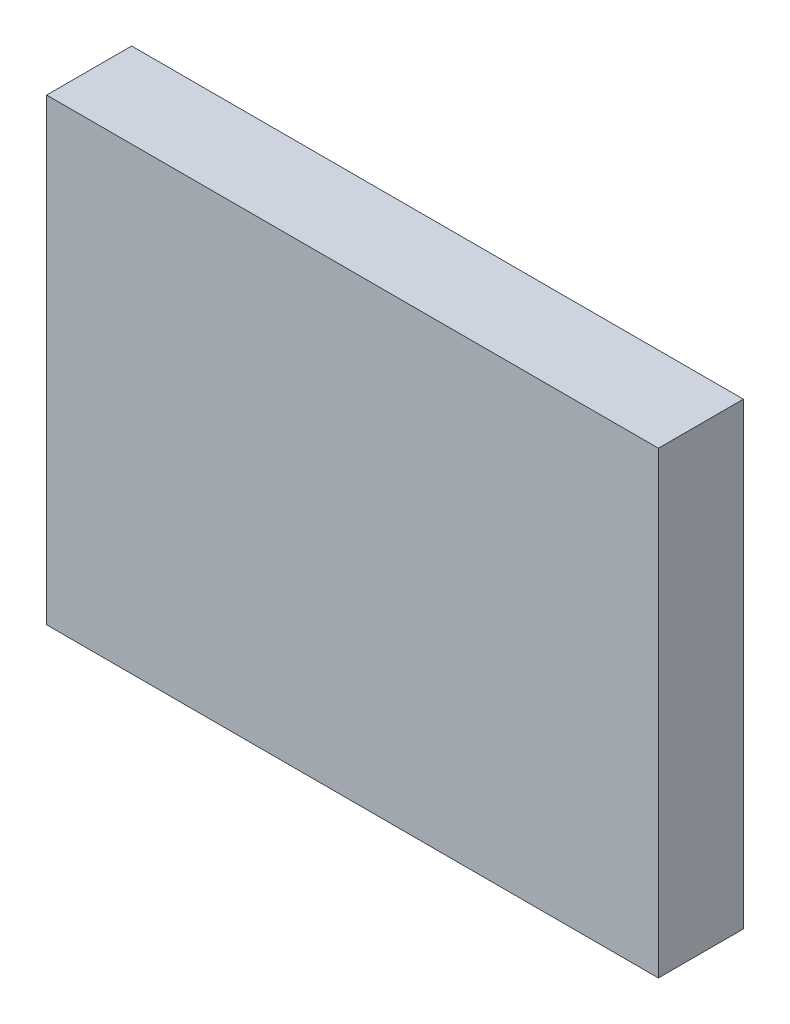
from build123d import *

# Parameters (mm, degrees)
SKETCH_1_W      = 360
SKETCH_1_H      = 270
EXTRUDE_1_DEPTH = 50


with BuildPart() as part:
    # Эскиз1 → Бобышка-Вытянуть1 (new body)
    with BuildSketch(Plane.XY):
        Rectangle(SKETCH_1_W, SKETCH_1_H)
    extrude(amount=EXTRUDE_1_DEPTH)


solid = part.part
